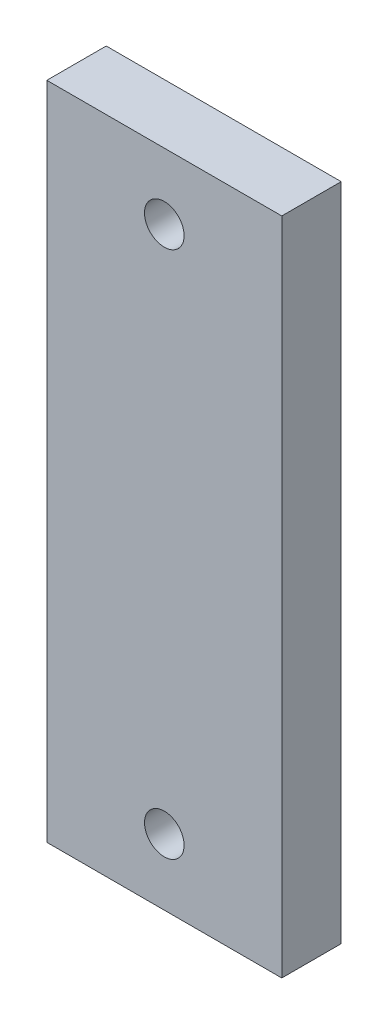
from build123d import *

# Parameters (mm, degrees)
SKETCH_1_W      = 17.8
SKETCH_1_H      = 50
SKETCH_1_R      = 1.5
EXTRUDE_1_DEPTH = 4.5


with BuildPart() as part:
    # 草图1 → 凸台-拉伸1 (new body)
    with BuildSketch(Plane.XY):
        Rectangle(SKETCH_1_W, SKETCH_1_H)
        with Locations((0, -20)):
            Circle(SKETCH_1_R, mode=Mode.SUBTRACT)
        with Locations((0, 20)):
            Circle(SKETCH_1_R, mode=Mode.SUBTRACT)
    extrude(amount=EXTRUDE_1_DEPTH)


solid = part.part
